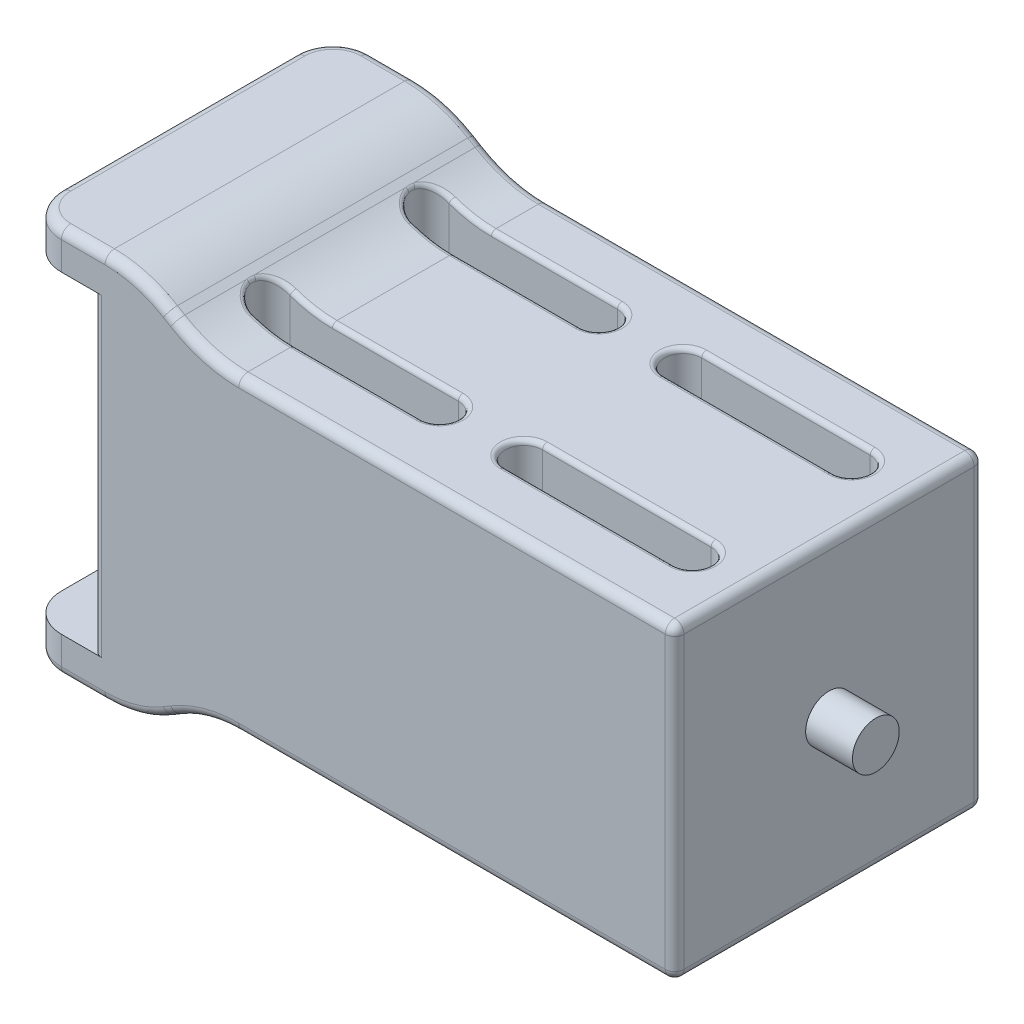
from build123d import *

# Parameters (mm, degrees)
BOSS_EXTRUDE1_DEPTH = 16.5
SKETCH5_R           = 2.5
BOSS_EXTRUDE2_DEPTH = 5
BOSS_EXTRUDE3_START = 5
SKETCH6_R           = 2.5
BOSS_EXTRUDE3_DEPTH = 5
FILLET1_R           = 13
FILLET2_R           = 4
CUT_EXTRUDE3_DEPTH  = 63.975074434
FILLET3_R           = 1
FILLET4_R           = 1
FILLET5_R           = 0.5


with BuildPart() as part:
    # Sketch1 → Boss-Extrude1 (new, symmetric)
    with BuildSketch(Plane.XY):
        Polygon((25.1, 16.5), (-25.1, 16.5), (-32.1, 20.75), (-44.4, 20.75), (-44.4, 16.75), (-37.1, 16.75), (-37.1, -16.75), (-44.4, -16.75), (-44.4, -20.75), (-32.1, -20.75), (-25.1, -16.5), (25.1, -16.5), align=None)
    extrude(amount=BOSS_EXTRUDE1_DEPTH, both=True)

    # Sketch5 → Boss-Extrude2 (add)
    with BuildSketch(Plane.ZY.offset(37.1)):
        with Locations(Location((0, 0, 0), (0, 0, 90))):
            Circle(SKETCH5_R)
    extrude(amount=BOSS_EXTRUDE2_DEPTH)

    # Sketch6 → Boss-Extrude3 (add)
    with BuildSketch(Plane(origin=(25.1, 0, 0), x_dir=(0, 0, -1), z_dir=(1, 0, 0)).offset(BOSS_EXTRUDE3_START)):
        with Locations(Location((0, 0, 0), (0, 0, 90))):
            Circle(SKETCH6_R)
    extrude(amount=-BOSS_EXTRUDE3_DEPTH)

    # Fillet1
    fillet1_edges = [part.edges().sort_by_distance(p)[0] for p in [
        (-25.1, -16.5, 0),
        (-32.1, -20.75, 0),
        (-32.1, 20.75, 0),
        (-25.1, 16.5, 0),
    ]]
    fillet(fillet1_edges, radius=FILLET1_R)

    # Fillet2
    fillet2_edges = [part.edges().sort_by_distance(p)[0] for p in [
        (-44.4, -18.75, -16.5),
        (-44.4, 18.75, -16.5),
        (-44.4, 18.75, 16.5),
        (-44.4, -18.75, 16.5),
    ]]
    fillet(fillet2_edges, radius=FILLET2_R)

    # Sketch7 → Cut-Extrude3 (cut, through all)
    with BuildSketch(Plane(origin=(0, 20.75, 0), x_dir=(1, 0, 0), z_dir=(0, 1, 0))):
        with BuildLine():
            Line((19, 6.5), (1, 6.5))
            ThreePointArc((1, 6.5), (-1, 8.5), (1, 10.5))
            Line((1, 10.5), (19, 10.5))
            ThreePointArc((19, 10.5), (21, 8.5), (19, 6.5))
        make_face()
        with BuildLine():
            Line((-26, 10.5), (-8, 10.5))
            ThreePointArc((-8, 10.5), (-6, 8.5), (-8, 6.5))
            Line((-8, 6.5), (-26, 6.5))
            ThreePointArc((-26, 6.5), (-28, 8.5), (-26, 10.5))
        make_face()
        with BuildLine():
            Line((19, -6.5), (1, -6.5))
            ThreePointArc((1, -6.5), (-1, -8.5), (1, -10.5))
            Line((1, -10.5), (19, -10.5))
            ThreePointArc((19, -10.5), (21, -8.5), (19, -6.5))
        make_face()
        with BuildLine():
            Line((-26, -10.5), (-8, -10.5))
            ThreePointArc((-8, -10.5), (-6, -8.5), (-8, -6.5))
            Line((-8, -6.5), (-26, -6.5))
            ThreePointArc((-26, -6.5), (-28, -8.5), (-26, -10.5))
        make_face()
    extrude(amount=-CUT_EXTRUDE3_DEPTH, mode=Mode.SUBTRACT)

    # Fillet3
    fillet3_edges = [part.edges().sort_by_distance(p)[0] for p in [
        (-37.1, 0, -16.5),
        (25.1, 0, -16.5),
        (-37.1, 0, 16.5),
        (25.1, 0, 16.5),
    ]]
    fillet(fillet3_edges, radius=FILLET3_R)

    # Fillet4
    fillet4_edges = [part.edges().sort_by_distance(p)[0] for p in [
        (1.318730094, 16.5, -16.5),
        (1.318730094, 16.5, 16.5),
        (25.1, 16.5, 0),
        (25.1, -16.5, 0),
        (24.807106781, 16.5, 16.207106781),
        (24.807106781, 16.5, -16.207106781),
        (24.807106781, -16.5, 16.207106781),
        (24.807106781, -16.5, -16.207106781),
        (-28.6, -18.625, -16.5),
        (-28.6, -18.625, 16.5),
        (1.318730094, -16.5, -16.5),
        (-38.068730094, 20.75, -16.5),
        (-28.6, 18.625, -16.5),
        (-32.23453927, 20.269167106, -16.5),
        (-32.23453927, -20.269167106, -16.5),
        (-28.6, 18.625, 16.5),
        (-38.068730094, 20.75, 16.5),
        (1.318730094, -16.5, 16.5),
        (-32.23453927, 20.269167106, 16.5),
        (-32.23453927, -20.269167106, 16.5),
        (-24.96546073, -16.980832894, -16.5),
        (-24.96546073, -16.980832894, 16.5),
        (-24.96546073, 16.980832894, -16.5),
        (-24.96546073, 16.980832894, 16.5),
        (-44.4, -20.75, 0),
        (-38.068730094, -20.75, -16.5),
        (-38.068730094, -20.75, 16.5),
        (-43.228427125, -20.75, 15.328427125),
        (-43.228427125, -20.75, -15.328427125),
        (-44.4, 20.75, 0),
        (-43.228427125, 20.75, 15.328427125),
        (-43.228427125, 20.75, -15.328427125),
    ]]
    fillet(fillet4_edges, radius=FILLET4_R)

    # Fillet5
    fillet5_edges = [part.edges().sort_by_distance(p)[0] for p in [
        (-23.767804191, 16.70602657, -6.5),
        (-28, 18.263380656, -8.5),
        (-23.767804191, 16.70602657, -10.5),
        (-6, -16.5, -8.5),
        (-6, 16.5, -8.5),
        (-28, -18.263380656, -8.5),
        (-14.731269906, -16.5, -10.5),
        (-23.767804191, -16.70602657, -10.5),
        (-14.731269906, 16.5, -10.5),
        (-23.767804191, -16.70602657, -6.5),
        (-14.731269906, -16.5, -6.5),
        (-14.731269906, 16.5, -6.5),
        (10, -16.5, 6.5),
        (-1, -16.5, 8.5),
        (10, -16.5, 10.5),
        (21, -16.5, 8.5),
        (21, 16.5, 8.5),
        (10, 16.5, 10.5),
        (-1, 16.5, 8.5),
        (10, 16.5, 6.5),
        (-23.767804191, 16.70602657, 10.5),
        (-28, 18.263380656, 8.5),
        (-23.767804191, 16.70602657, 6.5),
        (-6, -16.5, 8.5),
        (-6, 16.5, 8.5),
        (-28, -18.263380656, 8.5),
        (-14.731269906, -16.5, 6.5),
        (-23.767804191, -16.70602657, 6.5),
        (-14.731269906, 16.5, 6.5),
        (-23.767804191, -16.70602657, 10.5),
        (-14.731269906, -16.5, 10.5),
        (-14.731269906, 16.5, 10.5),
        (10, -16.5, -10.5),
        (-1, -16.5, -8.5),
        (10, -16.5, -6.5),
        (21, -16.5, -8.5),
        (21, 16.5, -8.5),
        (10, 16.5, -6.5),
        (-1, 16.5, -8.5),
        (10, 16.5, -10.5),
    ]]
    fillet(fillet5_edges, radius=FILLET5_R)


solid = part.part
